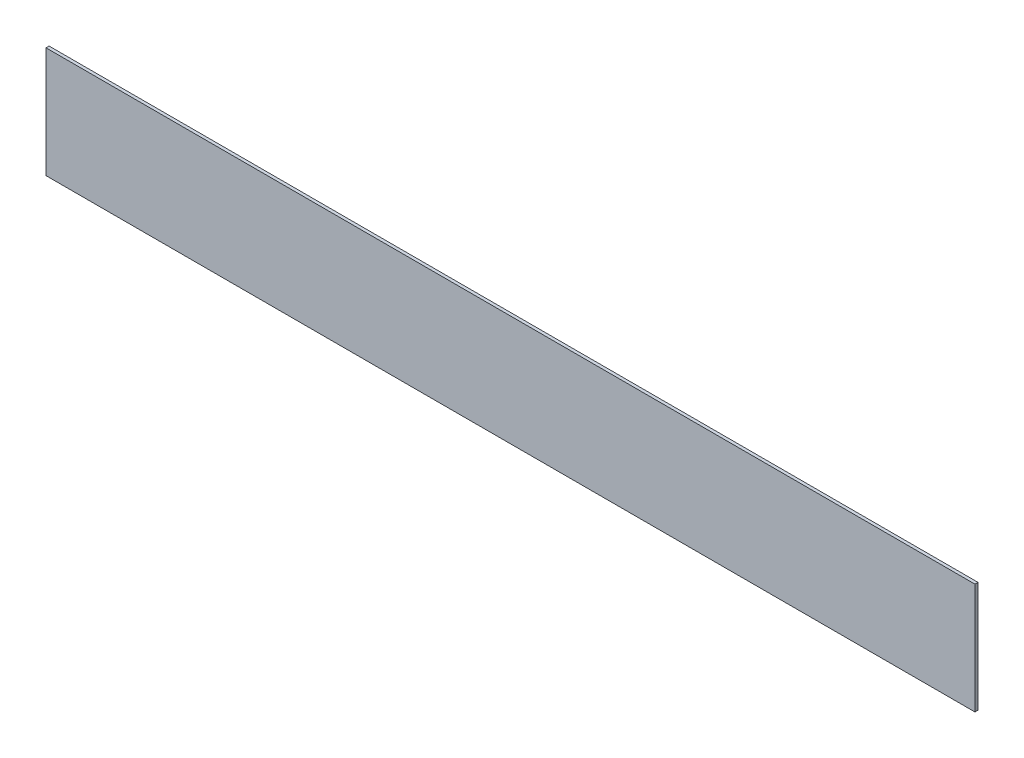
from build123d import *

# Parameters (mm, degrees)
CEK_DONMUS_KULP_CUKURU_1_0_1_START = 26
SKETCH1_W                          = 302
SKETCH1_H                          = 36
CEK_DONMUS_KULP_CUKURU_1_0_1_DEPTH = 1


with BuildPart() as part:
    # Sketch1 → CEK_donmus_kulp_cukuru_1.0_1 (new body)
    with BuildSketch(Plane.XY.offset(CEK_DONMUS_KULP_CUKURU_1_0_1_START)):
        with Locations((309, 45)):
            Rectangle(SKETCH1_W, SKETCH1_H)
    extrude(amount=CEK_DONMUS_KULP_CUKURU_1_0_1_DEPTH)


solid = part.part
